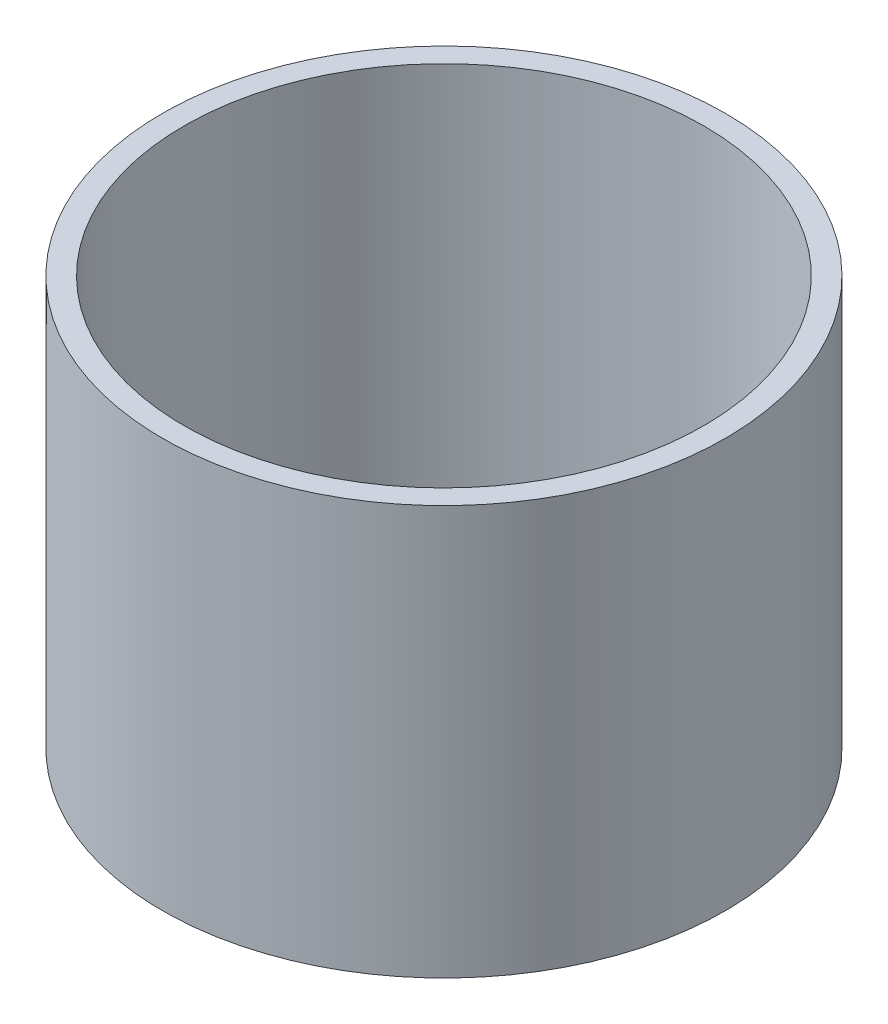
from build123d import *

# Parameters (mm, degrees)
SKETCH1_R           = 61.9125
SKETCH1_R_2         = 57.15
BOSS_EXTRUDE1_DEPTH = 90


with BuildPart() as part:
    # Sketch1 → Boss-Extrude1 (new body)
    with BuildSketch(Plane(origin=(0, 0, 0), x_dir=(1, 0, 0), z_dir=(0, 1, 0))):
        with Locations(Location((0, 0, 0), (0, 0, 90))):
            Circle(SKETCH1_R)
        with Locations(Location((0, 0, 0), (0, 0, 90))):
            Circle(SKETCH1_R_2, mode=Mode.SUBTRACT)
    extrude(amount=BOSS_EXTRUDE1_DEPTH)


solid = part.part
